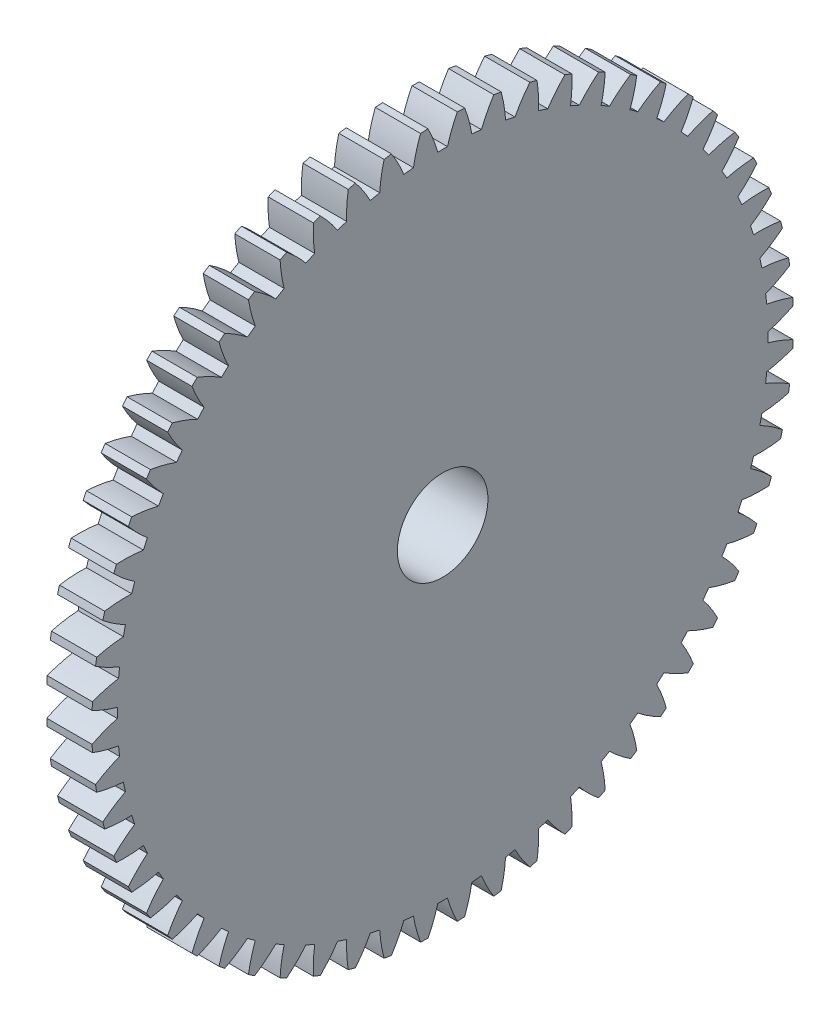
from build123d import *

# Parameters (mm, degrees)
BASPROSKE_W             = 6.35
BASPROSKE_H             = 49.2125
TOOTHCUT_DEPTH          = 70.886070232
TEETHCUTS_COUNT         = 60
TEETHCUTS_ANGLE         = 354
HUBNEAONESKE_R          = 15.875
HUBNEARONE_DEPTH        = 19.0500508
BORSKE_R                = 6.35
BORE_DEPTH              = 25.4000508
CUT_EXTRUDE1_DEPTH      = 73.098368242
CUT_EXTRUDE1_DEPTH_BACK = 73.098368242
SKETCH1_R               = 1.5875
FILLET1_R               = 1.27


with BuildPart() as part:
    # BasProSke → Base-Revolve (revolve)
    with BuildSketch(Plane(origin=(0, 0, 0), x_dir=(1, 0, 0), z_dir=(0, 1, 0)), mode=Mode.PRIVATE) as base_revolve_sk:
        with Locations((3.175, 24.60625)):
            Rectangle(BASPROSKE_W, BASPROSKE_H)
    revolve(base_revolve_sk.sketch.rotate(Axis((-10, 0, 0), (1, 0, 0)), 180), axis=Axis((-10, 0, 0), (1, 0, 0)))

    # TooCutSke → ToothCut (cut, through all)
    with BuildSketch(Plane(origin=(0, 0, 0), x_dir=(0, 0, -1), z_dir=(1, 0, 0))):
        with BuildLine():
            ThreePointArc((0.677629112, 45.634324183), (0, 45.639355), (-0.677629112, 45.634324183))
            ThreePointArc((-0.677629112, 45.634324183), (-1.284610751, 47.449364082), (-2.070645609, 49.194341373))
            ThreePointArc((-2.070645609, 49.194341373), (0, 49.2379), (2.070645609, 49.194341373))
            ThreePointArc((2.070645609, 49.194341373), (1.284610751, 47.449364082), (0.677629112, 45.634324183))
        make_face()
    toothcut = extrude(amount=TOOTHCUT_DEPTH, mode=Mode.SUBTRACT)

    # TeethCuts: ToothCut ×60 about axis
    teethcuts_axis = Axis((-10, 0, 0), (1, 0, 0))
    for i in range(1, TEETHCUTS_COUNT):
        add(toothcut.rotate(teethcuts_axis, i * TEETHCUTS_ANGLE / (TEETHCUTS_COUNT - 1)), mode=Mode.SUBTRACT)

    # HubNeaOneSke → HubNearOne (add)
    with BuildSketch(Plane.ZY):
        with Locations(Location((0, 0, 0), (0, 0, 180))):
            Circle(HUBNEAONESKE_R)
    extrude(amount=HUBNEARONE_DEPTH)

    # BorSke → Bore (cut, symmetric)
    with BuildSketch(Plane(origin=(0, 0, 0), x_dir=(0, 0, -1), z_dir=(1, 0, 0))):
        with Locations(Location((0, 0, 0), (0, 0, 180))):
            Circle(BORSKE_R)
    extrude(amount=BORE_DEPTH, both=True, mode=Mode.SUBTRACT)

    # Sketch1 → Cut-Extrude1 (cut, two sides: drawn at the far end of the back side and taken through both)
    with BuildSketch(Plane.XY.offset(-CUT_EXTRUDE1_DEPTH_BACK)):
        with Locations((-9.5250254, 0)):
            Circle(SKETCH1_R)
    extrude(amount=CUT_EXTRUDE1_DEPTH + CUT_EXTRUDE1_DEPTH_BACK, mode=Mode.SUBTRACT)

    # Fillet1
    fillet1_edges = [part.edges().sort_by_distance(p)[0] for p in [
        (0, 0, 15.875),
        (-19.0500508, 0, 15.875),
        (-19.0500508, 0, -6.35),
    ]]
    fillet(fillet1_edges, radius=FILLET1_R)


solid = part.part
